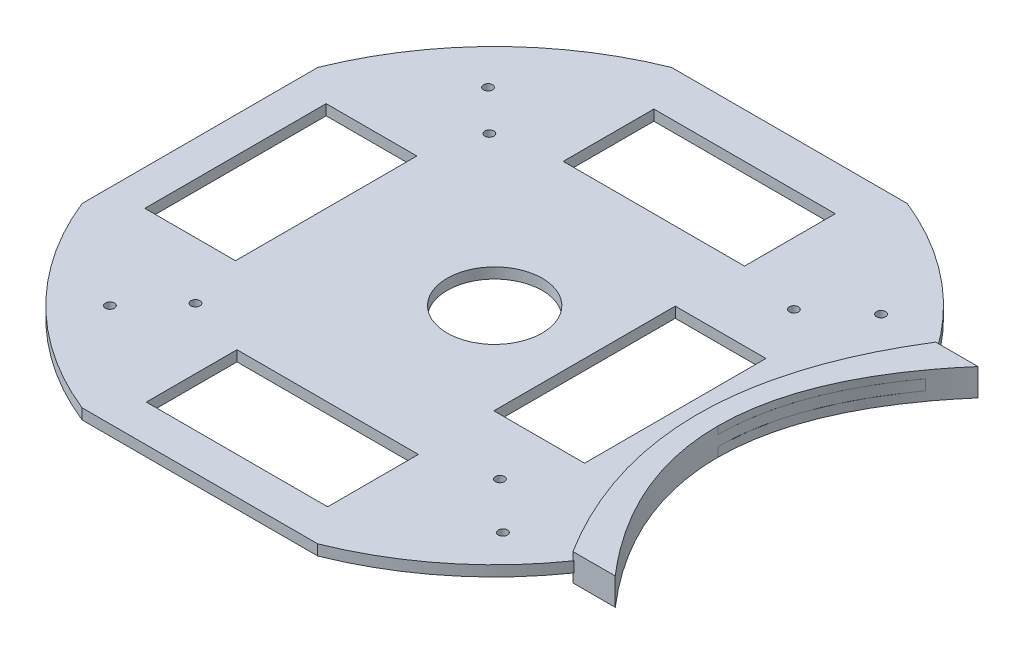
from build123d import *

# Parameters (mm, degrees)
SKETCH1_W                = 195
SKETCH1_H                = 195
BOSS_EXTRUDE3_DEPTH      = 3.5
SKETCH2_R                = 177.836364648
SKETCH2_R_2              = 105
CUT_EXTRUDE2_DEPTH       = 30
SKETCH4_W                = 30
SKETCH4_H                = 60
SKETCH4_W_2              = 60
SKETCH4_H_2              = 30
CUT_EXTRUDE7_DEPTH       = 5
BOSS_EXTRUDE5_DEPTH      = 6
BOSS_EXTRUDE5_DEPTH_BACK = 3
CUT_EXTRUDE12_DEPTH      = 6
CUT_EXTRUDE12_DEPTH_BACK = 6
SKETCH13_R               = 1.5
SKETCH13_R_2             = 15.721905528
TOP_TO_MID_STAND_DEPTH   = 6
SKETCH14_R               = 1.5
MIT_TO_BOT_STAND_DEPTH   = 6


with BuildPart() as part:
    # Sketch1 → Boss-Extrude3 (new body)
    with BuildSketch(Plane(origin=(0, 0, 0), x_dir=(1, 0, 0), z_dir=(0, 1, 0))):
        Rectangle(SKETCH1_W, SKETCH1_H)
    extrude(amount=BOSS_EXTRUDE3_DEPTH)

    # Sketch2 → Cut-Extrude2 (cut)
    with BuildSketch(Plane(origin=(0, 0, 0), x_dir=(1, 0, 0), z_dir=(0, 1, 0))):
        Circle(SKETCH2_R)
        Circle(SKETCH2_R_2, mode=Mode.SUBTRACT)
    extrude(amount=CUT_EXTRUDE2_DEPTH, mode=Mode.SUBTRACT)

    # Sketch4 → Cut-Extrude7 (cut)
    with BuildSketch(Plane(origin=(0, 0, 0), x_dir=(1, 0, 0), z_dir=(0, 1, 0))):
        with Locations((45, -0.259206865)):
            Rectangle(SKETCH4_W, SKETCH4_H)
        with Locations((0, 67.669311598)):
            Rectangle(SKETCH4_W_2, SKETCH4_H_2)
        with Locations((-70.744213578, 0)):
            Rectangle(SKETCH4_W, SKETCH4_H)
        with Locations((0, -70.245377815)):
            Rectangle(SKETCH4_W_2, SKETCH4_H_2)
    extrude(amount=CUT_EXTRUDE7_DEPTH, mode=Mode.SUBTRACT)

    # Sketch6 → Boss-Extrude5 (add, two sides: drawn at the far end of the back side and taken through both)
    with BuildSketch(Plane(origin=(0, 0, 0), x_dir=(1, 0, 0), z_dir=(0, 1, 0)).offset(-BOSS_EXTRUDE5_DEPTH_BACK)):
        with BuildLine():
            Line((99.887770318, 60), (85.887770318, 60))
            add(Edge.make_bspline(
                [(85.887770318, 60), (48.439587705, 0), (85.887770318, -60)],
                knots=[0, 0, 0, 1, 1, 1], degree=2))
            Line((85.887770318, -60), (99.887770318, -60))
            add(Edge.make_bspline(
                [(99.887770318, 60), (47.863555335, 0), (99.887770318, -60)],
                knots=[0, 0, 0, 1, 1, 1], degree=2))
        make_face()
    extrude(amount=BOSS_EXTRUDE5_DEPTH + BOSS_EXTRUDE5_DEPTH_BACK)

    # Sketch11 → Cut-Extrude12 (cut, two sides: drawn at the far end of the back side and taken through both)
    with BuildSketch(Plane(origin=(0, 0, 0), x_dir=(1, 0, 0), z_dir=(0, 1, 0)).offset(-CUT_EXTRUDE12_DEPTH_BACK)):
        with BuildLine():
            Line((99.887770318, -60), (114.577459752, -60))
            Line((114.577459752, -60), (112.469175223, 59.986841606))
            Line((112.469175223, 59.986841606), (99.887770318, 59.986841606))
            add(Edge.make_bspline(
                [(99.887770318, 59.986841606), (47.863554892, -0.004496949), (99.887770318, -60)],
                knots=[0, 0, 0, 1, 1, 1], degree=2))
        make_face()
    extrude(amount=CUT_EXTRUDE12_DEPTH + CUT_EXTRUDE12_DEPTH_BACK, mode=Mode.SUBTRACT)

    # Sketch13 → top to mid stand (cut)
    with BuildSketch(Plane(origin=(0, 0, 0), x_dir=(1, 0, 0), z_dir=(0, 1, 0))):
        with Locations(Location((-63.643035227, 61.463814798, 0), (0, 0, 90))):
            Circle(SKETCH13_R)
        with Locations(Location((66.356964773, 61.463814798, 0), (0, 0, 90))):
            Circle(SKETCH13_R)
        with Locations(Location((66.356964773, -63.636185202, 0), (0, 0, 90))):
            Circle(SKETCH13_R)
        with Locations(Location((-63.643035227, -63.636185202, 0), (0, 0, 90))):
            Circle(SKETCH13_R)
        with Locations(Location((0, 0, 0), (0, 0, 90))):
            Circle(SKETCH13_R_2)
    extrude(amount=TOP_TO_MID_STAND_DEPTH, mode=Mode.SUBTRACT)

    # Sketch14 → mit to bot stand (cut)
    with BuildSketch(Plane(origin=(0, 0, 0), x_dir=(1, 0, 0), z_dir=(0, 1, 0))):
        with Locations(Location((-50.173994207, 48.41640264, 0), (0, 0, 90))):
            Circle(SKETCH14_R)
        with Locations(Location((50.556931854, 48.41640264, 0), (0, 0, 90))):
            Circle(SKETCH14_R)
        with Locations(Location((50.556931854, -48.811579623, 0), (0, 0, 90))):
            Circle(SKETCH14_R)
        with Locations(Location((-50.173994207, -48.811579623, 0), (0, 0, 90))):
            Circle(SKETCH14_R)
    extrude(amount=MIT_TO_BOT_STAND_DEPTH, mode=Mode.SUBTRACT)


solid = part.part
